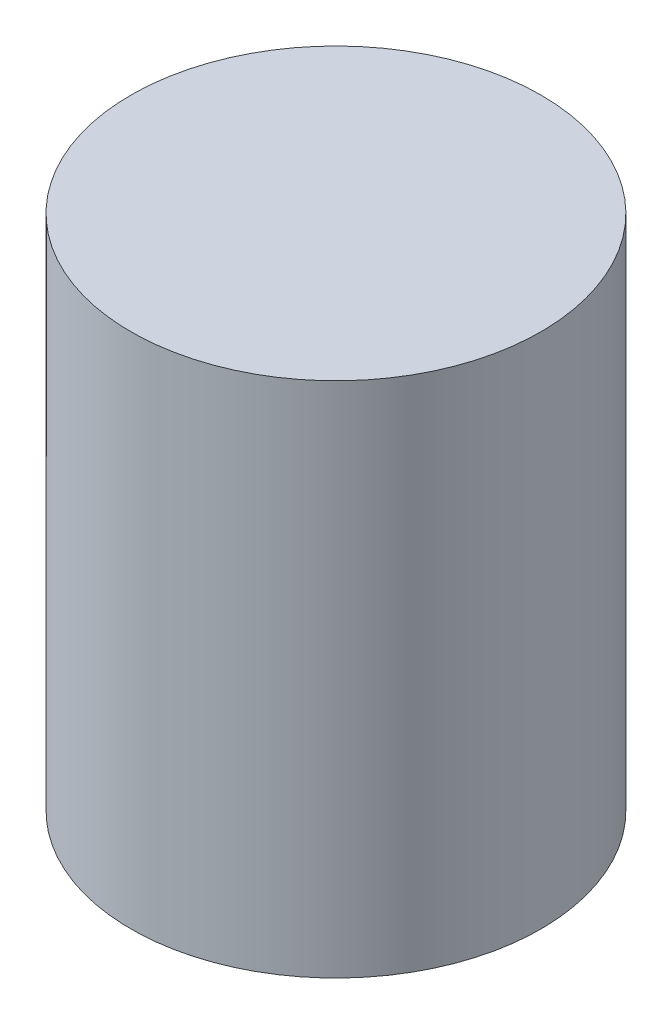
from build123d import *

# Parameters (mm, degrees)
SCHIZZO1_W = 2
SCHIZZO1_H = 10.457904347


with BuildPart() as part:
    # Schizzo1 → Rivoluzione1 (revolve)
    with BuildSketch(Plane.XY, mode=Mode.PRIVATE) as rivoluzione1_sk:
        Polygon((-20, 40), (-20, 0), (-14, 0), (-14, 35), (0, 35), (0, 40), align=None)
        with Locations((-19, -5.228952174)):
            Rectangle(SCHIZZO1_W, SCHIZZO1_H)
    revolve(rivoluzione1_sk.sketch.rotate(Axis((0, 0, 0), (0, 1, 0)), 270), axis=Axis((0, 0, 0), (0, 1, 0)))


solid = part.part
